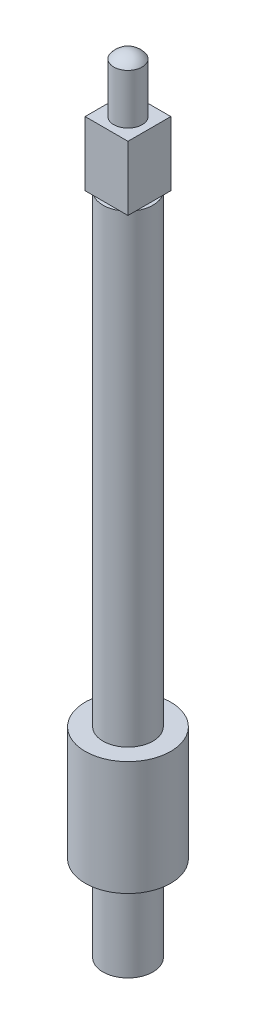
from build123d import *

# Parameters (mm, degrees)
SKETCH1_R                   = 5.985
BOSS_EXTRUDE1_DEPTH         = 16
SKETCH2_R                   = 3.5
BOSS_EXTRUDE2_DEPTH         = 65
SKETCH3_W                   = 6
SKETCH3_H                   = 6
BOSS_EXTRUDE3_DEPTH         = 9
SKETCH4_R                   = 1.99
BOSS_EXTRUDE4_DEPTH         = 7
BOSS_EXTRUDE5_START         = 12
SKETCH5_R                   = 3.5
BOSS_EXTRUDE5_DEPTH         = 12
TAP_DRILL_FOR_M4_TAP1_D     = 3.3
TAP_DRILL_FOR_M4_TAP1_DEPTH = 9
TAP_DRILL_FOR_M4_TAP1_TIP   = 0.991420021
DOME1_FACE_RADIUS           = 1.99
DOME1_HEIGHT                = 1


with BuildPart() as part:
    # Sketch1 → Boss-Extrude1 (new body)
    with BuildSketch(Plane(origin=(0, 0, 0), x_dir=(1, 0, 0), z_dir=(0, 1, 0))):
        with Locations(Location((0, 0, 0), (0, 0, 270))):
            Circle(SKETCH1_R)
    extrude(amount=BOSS_EXTRUDE1_DEPTH)

    # Sketch2 → Boss-Extrude2 (add)
    with BuildSketch(Plane(origin=(0, 16, 0), x_dir=(1, 0, 0), z_dir=(0, 1, 0))):
        with Locations(Location((0, 0, 0), (0, 0, 270))):
            Circle(SKETCH2_R)
    extrude(amount=BOSS_EXTRUDE2_DEPTH)

    # Sketch3 → Boss-Extrude3 (add)
    with BuildSketch(Plane(origin=(0, 81, 0), x_dir=(1, 0, 0), z_dir=(0, 1, 0))):
        Rectangle(SKETCH3_W, SKETCH3_H)
    extrude(amount=BOSS_EXTRUDE3_DEPTH)

    # Sketch4 → Boss-Extrude4 (add)
    with BuildSketch(Plane(origin=(0, 90, 0), x_dir=(1, 0, 0), z_dir=(0, 1, 0))):
        with Locations(Location((0, 0, 0), (0, 0, 270))):
            Circle(SKETCH4_R)
    extrude(amount=BOSS_EXTRUDE4_DEPTH)

    # Sketch5 → Boss-Extrude5 (add)
    with BuildSketch(Plane.XZ.offset(BOSS_EXTRUDE5_START)):
        with Locations(Location((0, 0, 0), (0, 0, 238.997280866))):
            Circle(SKETCH5_R)
    extrude(amount=-BOSS_EXTRUDE5_DEPTH)

    # Tap Drill for M4 Tap1
    with Locations(Plane(origin=(0, -12, 0), x_dir=(-1, 0, 0), z_dir=(0, -1, 0))):
        with Locations((0, 0)):
            Hole(TAP_DRILL_FOR_M4_TAP1_D / 2, depth=TAP_DRILL_FOR_M4_TAP1_DEPTH)
            with Locations((0, 0, -(TAP_DRILL_FOR_M4_TAP1_DEPTH + TAP_DRILL_FOR_M4_TAP1_TIP / 2))):  # 118° drill point
                Cone(0, TAP_DRILL_FOR_M4_TAP1_D / 2, TAP_DRILL_FOR_M4_TAP1_TIP, mode=Mode.SUBTRACT)

    # Dome1: a dome of height H over a round flat face of radius A is a cap of a sphere of radius (A * A + H * H) / (2 * H)
    dome1_r = (DOME1_FACE_RADIUS * DOME1_FACE_RADIUS + DOME1_HEIGHT * DOME1_HEIGHT) / (2 * DOME1_HEIGHT)
    dome1_base = Plane((0, 97, 0), z_dir=(0, 1, 0))
    with Locations(dome1_base.offset(DOME1_HEIGHT - dome1_r)):
        dome1_ball = Sphere(dome1_r, mode=Mode.PRIVATE)
    add(split(dome1_ball, bisect_by=dome1_base, keep=Keep.TOP, mode=Mode.PRIVATE))


solid = part.part
